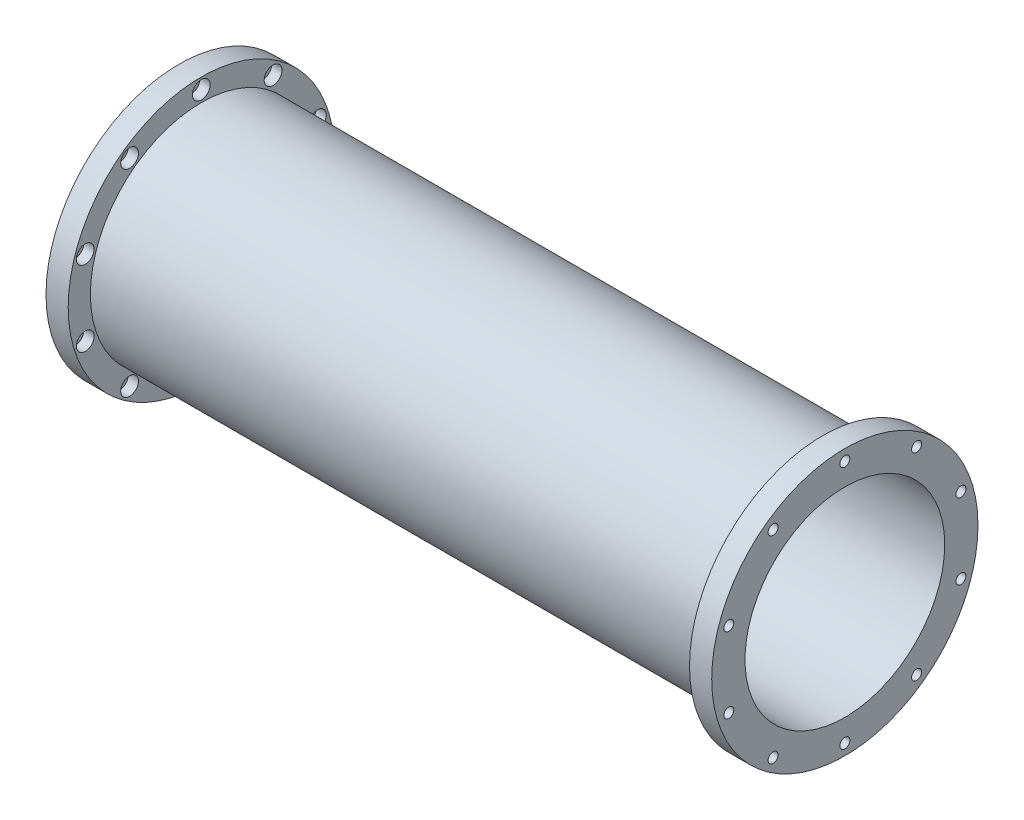
from build123d import *

# Parameters (mm, degrees)
SKETCH_3_R                  = 45
CUT_EXTRUDE_1_DEPTH         = 312.769145362
HOLE_WIZARD_4_D             = 4.5
HOLE_WIZARD_4_DEPTH         = 10
HOLE_WIZARD_4_CBORE_D       = 8
HOLE_WIZARD_4_CBORE_DEPTH   = 4.6
PATTERN_CIRCULAR_1_COUNT    = 10
MIRROR_1_COPY_1_D           = 4.5
MIRROR_1_COPY_1_DEPTH       = 10
MIRROR_1_COPY_1_CBORE_D     = 8
MIRROR_1_COPY_1_CBORE_DEPTH = 4.6
MIRROR_1_COPY_2_D           = 4.5
MIRROR_1_COPY_2_DEPTH       = 10
MIRROR_1_COPY_2_CBORE_D     = 8
MIRROR_1_COPY_2_CBORE_DEPTH = 4.6
MIRROR_1_COPY_3_D           = 4.5
MIRROR_1_COPY_3_DEPTH       = 10
MIRROR_1_COPY_3_CBORE_D     = 8
MIRROR_1_COPY_3_CBORE_DEPTH = 4.6
MIRROR_1_COPY_4_D           = 4.5
MIRROR_1_COPY_4_DEPTH       = 10
MIRROR_1_COPY_4_CBORE_D     = 8
MIRROR_1_COPY_4_CBORE_DEPTH = 4.6
MIRROR_1_COPY_5_D           = 4.5
MIRROR_1_COPY_5_DEPTH       = 10
MIRROR_1_COPY_5_CBORE_D     = 8
MIRROR_1_COPY_5_CBORE_DEPTH = 4.6
MIRROR_1_COPY_6_D           = 4.5
MIRROR_1_COPY_6_DEPTH       = 10
MIRROR_1_COPY_6_CBORE_D     = 8
MIRROR_1_COPY_6_CBORE_DEPTH = 4.6
MIRROR_1_COPY_7_D           = 4.5
MIRROR_1_COPY_7_DEPTH       = 10
MIRROR_1_COPY_7_CBORE_D     = 8
MIRROR_1_COPY_7_CBORE_DEPTH = 4.6
MIRROR_1_COPY_8_D           = 4.5
MIRROR_1_COPY_8_DEPTH       = 10
MIRROR_1_COPY_8_CBORE_D     = 8
MIRROR_1_COPY_8_CBORE_DEPTH = 4.6
MIRROR_1_COPY_9_D           = 4.5
MIRROR_1_COPY_9_DEPTH       = 10
MIRROR_1_COPY_9_CBORE_D     = 8
MIRROR_1_COPY_9_CBORE_DEPTH = 4.6


with BuildPart() as part:
    # 草图1 → 旋转1 (revolve)
    with BuildSketch(Plane.XY, mode=Mode.PRIVATE) as revolve_1_sk:
        Polygon((140, 50), (-140, 50), (-140, 60), (-150, 60), (-150, 0), (150, 0), (150, 60), (140, 60), align=None)
    revolve(revolve_1_sk.sketch.rotate(Axis((-150, 0, 0), (1, 0, 0)), 90), axis=Axis((-150, 0, 0), (1, 0, 0)))

    # 草图3 → 切除-拉伸1 (cut, through all)
    with BuildSketch(Plane(origin=(150, 0, 0), x_dir=(0, 0, -1), z_dir=(1, 0, 0))):
        Circle(SKETCH_3_R)
    extrude(amount=-CUT_EXTRUDE_1_DEPTH, mode=Mode.SUBTRACT)

    # 打孔尺寸(%根据)内六角圆柱头螺钉的类型4
    with Locations(Plane(origin=(-140, 0, 0), x_dir=(0, 0, -1), z_dir=(1, 0, 0))):
        with Locations((0, 55)):
            hole_wizard_4 = CounterBoreHole(HOLE_WIZARD_4_D / 2, HOLE_WIZARD_4_CBORE_D / 2, HOLE_WIZARD_4_CBORE_DEPTH, depth=HOLE_WIZARD_4_DEPTH)

    # 阵列(圆周)1: 打孔尺寸(%根据)内六角圆柱头螺钉的类型4 ×10 about axis
    pattern_circular_1_axis = Axis((0, 0, 0), (1, 0, 0))
    for i in range(1, PATTERN_CIRCULAR_1_COUNT):
        add(hole_wizard_4.rotate(pattern_circular_1_axis, i * 360 / PATTERN_CIRCULAR_1_COUNT), mode=Mode.SUBTRACT)

    # 镜向1: 打孔尺寸(%根据)内六角圆柱头螺钉的类型4 across plane
    add(hole_wizard_4.mirror(Plane(origin=(0, 0, 0), x_dir=(0, 0, 1), z_dir=(1, 0, 0))), mode=Mode.SUBTRACT)

    # 镜向1 copy 1
    with Locations(Plane(origin=(140, 0, 0), x_dir=(0, 0.5877852522924731, -0.8090169943749475), z_dir=(-1, 0, 0))):
        with Locations((0, -55)):
            CounterBoreHole(MIRROR_1_COPY_1_D / 2, MIRROR_1_COPY_1_CBORE_D / 2, MIRROR_1_COPY_1_CBORE_DEPTH, depth=MIRROR_1_COPY_1_DEPTH)

    # 镜向1 copy 2
    with Locations(Plane(origin=(140, 0, 0), x_dir=(0, 0.9510565162951535, -0.30901699437494745), z_dir=(-1, 0, 0))):
        with Locations((0, -55)):
            CounterBoreHole(MIRROR_1_COPY_2_D / 2, MIRROR_1_COPY_2_CBORE_D / 2, MIRROR_1_COPY_2_CBORE_DEPTH, depth=MIRROR_1_COPY_2_DEPTH)

    # 镜向1 copy 3
    with Locations(Plane(origin=(140, 0, 0), x_dir=(0, 0.9510565162951536, 0.30901699437494734), z_dir=(-1, 0, 0))):
        with Locations((0, -55)):
            CounterBoreHole(MIRROR_1_COPY_3_D / 2, MIRROR_1_COPY_3_CBORE_D / 2, MIRROR_1_COPY_3_CBORE_DEPTH, depth=MIRROR_1_COPY_3_DEPTH)

    # 镜向1 copy 4
    with Locations(Plane(origin=(140, 0, 0), x_dir=(0, 0.5877852522924732, 0.8090169943749473), z_dir=(-1, 0, 0))):
        with Locations((0, -55)):
            CounterBoreHole(MIRROR_1_COPY_4_D / 2, MIRROR_1_COPY_4_CBORE_D / 2, MIRROR_1_COPY_4_CBORE_DEPTH, depth=MIRROR_1_COPY_4_DEPTH)

    # 镜向1 copy 5
    with Locations(Plane.ZY.offset(-140)):
        with Locations((0, -55)):
            CounterBoreHole(MIRROR_1_COPY_5_D / 2, MIRROR_1_COPY_5_CBORE_D / 2, MIRROR_1_COPY_5_CBORE_DEPTH, depth=MIRROR_1_COPY_5_DEPTH)

    # 镜向1 copy 6
    with Locations(Plane(origin=(140, 0, 0), x_dir=(0, -0.587785252292473, 0.8090169943749476), z_dir=(-1, 0, 0))):
        with Locations((0, -55)):
            CounterBoreHole(MIRROR_1_COPY_6_D / 2, MIRROR_1_COPY_6_CBORE_D / 2, MIRROR_1_COPY_6_CBORE_DEPTH, depth=MIRROR_1_COPY_6_DEPTH)

    # 镜向1 copy 7
    with Locations(Plane(origin=(140, 0, 0), x_dir=(0, -0.9510565162951535, 0.30901699437494756), z_dir=(-1, 0, 0))):
        with Locations((0, -55)):
            CounterBoreHole(MIRROR_1_COPY_7_D / 2, MIRROR_1_COPY_7_CBORE_D / 2, MIRROR_1_COPY_7_CBORE_DEPTH, depth=MIRROR_1_COPY_7_DEPTH)

    # 镜向1 copy 8
    with Locations(Plane(origin=(140, 0, 0), x_dir=(0, -0.9510565162951536, -0.30901699437494723), z_dir=(-1, 0, 0))):
        with Locations((0, -55)):
            CounterBoreHole(MIRROR_1_COPY_8_D / 2, MIRROR_1_COPY_8_CBORE_D / 2, MIRROR_1_COPY_8_CBORE_DEPTH, depth=MIRROR_1_COPY_8_DEPTH)

    # 镜向1 copy 9
    with Locations(Plane(origin=(140, 0, 0), x_dir=(0, -0.5877852522924734, -0.8090169943749473), z_dir=(-1, 0, 0))):
        with Locations((0, -55)):
            CounterBoreHole(MIRROR_1_COPY_9_D / 2, MIRROR_1_COPY_9_CBORE_D / 2, MIRROR_1_COPY_9_CBORE_DEPTH, depth=MIRROR_1_COPY_9_DEPTH)


solid = part.part
